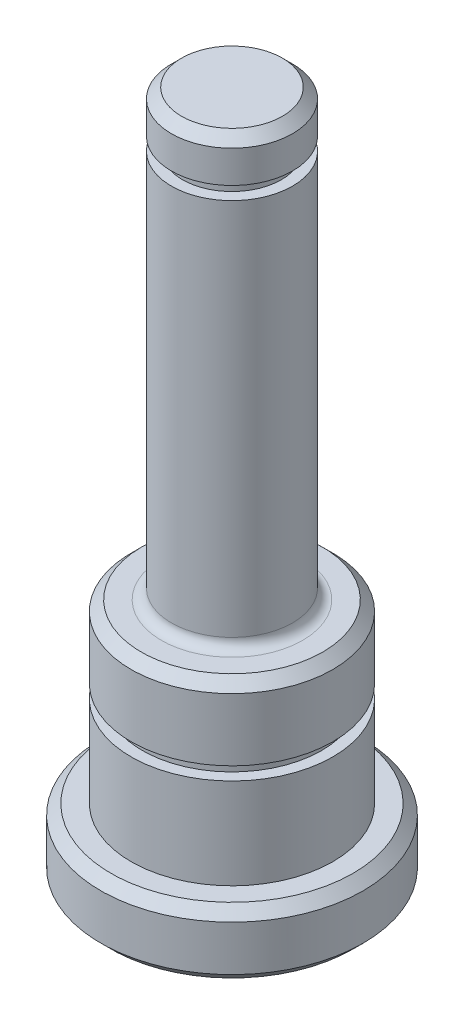
from build123d import *

# Parameters (mm, degrees)
CHAMFER1_SIZE = 1
FILLET2_R     = 1


with BuildPart() as part:
    # Sketch1 → Revolve1 (revolve)
    with BuildSketch(Plane.XY):
        Polygon((-5, 0), (-13, 0), (-13, 6.5), (-10, 6.5), (-10, 15.5), (-8.9, 15.5), (-8.9, 16.8), (-10, 16.8), (-10, 24), (-6, 24), (-6, 62.5), (-4.9, 62.5), (-4.9, 63.8), (-6, 63.8), (-6, 68), (0, 68), (0, 18), (-5, 18), align=None)
    revolve(axis=Axis((0, 0, 0), (0, 1, 0)))

    # Chamfer1
    chamfer1_edges = [part.edges().sort_by_distance(p)[0] for p in [
        (5, 0, 0),
        (13, 0, 0),
        (13, 6.5, 0),
        (10, 24, 0),
        (6, 68, 0),
    ]]
    chamfer(chamfer1_edges, length=CHAMFER1_SIZE)

    # Fillet2
    fillet2_edges = [part.edges().sort_by_distance(p)[0] for p in [
        (6, 24, 0),
    ]]
    fillet(fillet2_edges, radius=FILLET2_R)


solid = part.part
